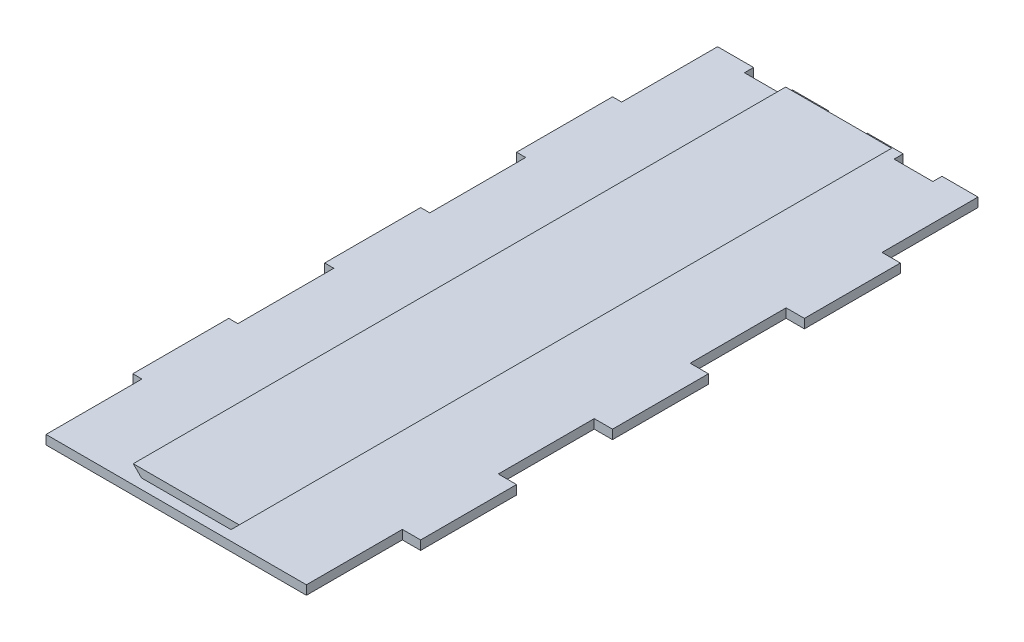
from build123d import *

# Parameters (mm, degrees)
SKETCH_4_W      = 57
SKETCH_4_H      = 145
EXTRUDE_1_DEPTH = 2
SKETCH_5_W      = 7.875
SKETCH_5_H      = 2
EXTRUDE_2_DEPTH = 2
SKETCH_6_W      = 21
SKETCH_6_H      = 2
EXTRUDE_3_DEPTH = 2
EXTRUDE_START   = -57
SKETCH_6_2_W    = 21
SKETCH_6_2_H    = 2
EXTRUDE_4_DEPTH = 4
EXTRUDE_START_2 = -2.2
EXTRUDE_5_DEPTH = 142.8


with BuildPart() as part:
    # 草图4 → 凸台-拉伸1 (new body)
    with BuildSketch(Plane(origin=(0, 0, 0), x_dir=(1, 0, 0), z_dir=(0, 1, 0))):
        Rectangle(SKETCH_4_W, SKETCH_4_H)
    extrude(amount=EXTRUDE_1_DEPTH)

    # 草图5 → 凸台-拉伸2 (add)
    with BuildSketch(Plane(origin=(0, 0, -72.5), x_dir=(-1, 0, 0), z_dir=(0, 0, -1))):
        with Locations((-24.5625, 1)):
            Rectangle(SKETCH_5_W, SKETCH_5_H)
        with Locations((-8.1875, 1)):
            Rectangle(SKETCH_5_W, SKETCH_5_H)
        with Locations((8.1875, 1)):
            Rectangle(SKETCH_5_W, SKETCH_5_H)
        with Locations((24.5625, 1)):
            Rectangle(SKETCH_5_W, SKETCH_5_H)
    extrude(amount=EXTRUDE_2_DEPTH)

    # 草图6 → 凸台-拉伸3 (add)
    with BuildSketch(Plane.ZY.offset(28.5)):
        with Locations((-43, 1)):
            Rectangle(SKETCH_6_W, SKETCH_6_H)
        with Locations((-1, 1)):
            Rectangle(SKETCH_6_W, SKETCH_6_H)
        with Locations((41, 1)):
            Rectangle(SKETCH_6_W, SKETCH_6_H)
    extrude(amount=EXTRUDE_3_DEPTH)

    # 草图6<2> → 凸台-拉伸4 (add)
    with BuildSketch(Plane.ZY.offset(28.5).offset(EXTRUDE_START)):
        with Locations((-43, 1)):
            Rectangle(SKETCH_6_2_W, SKETCH_6_2_H)
        with Locations((-1, 1)):
            Rectangle(SKETCH_6_2_W, SKETCH_6_2_H)
        with Locations((41, 1)):
            Rectangle(SKETCH_6_2_W, SKETCH_6_2_H)
    extrude(amount=-EXTRUDE_4_DEPTH)

    # 草图8 → 凸台-拉伸5 (add)
    with BuildSketch(Plane.XY.offset(72.5).offset(EXTRUDE_START_2)):
        Polygon((-11.6, 3.8), (-9.8, 2), (9.8, 2), (11.6, 3.8), (9.8, 3.8), (-9.8, 3.8), align=None)
    extrude(amount=-EXTRUDE_5_DEPTH)


solid = part.part
